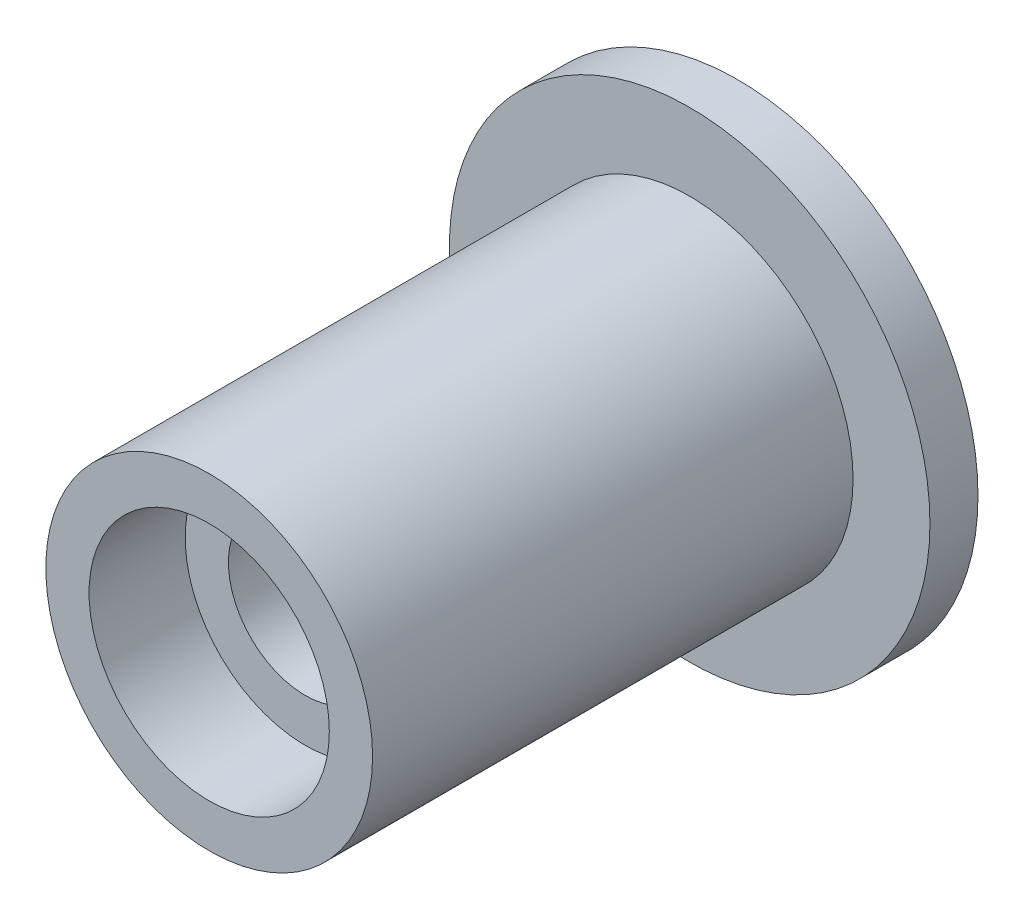
from build123d import *

# Parameters (mm, degrees)
SKETCH1_R           = 5
SKETCH1_R_2         = 1.6
BOSS_EXTRUDE1_DEPTH = 1
SKETCH1_3_R         = 3.4
SKETCH1_3_R_2       = 2.5
BOSS_EXTRUDE2_DEPTH = 10
SKETCH1_4_R         = 2.5
SKETCH1_4_R_2       = 1.6
BOSS_EXTRUDE3_DEPTH = 8


with BuildPart() as part:
    # Sketch1 → Boss-Extrude1 (new body)
    with BuildSketch(Plane.XY):
        Circle(SKETCH1_R)
        Circle(SKETCH1_R_2, mode=Mode.SUBTRACT)
    extrude(amount=-BOSS_EXTRUDE1_DEPTH)

    # Sketch1<3> → Boss-Extrude2 (add)
    with BuildSketch(Plane.XY):
        Circle(SKETCH1_3_R)
        Circle(SKETCH1_3_R_2, mode=Mode.SUBTRACT)
    extrude(amount=BOSS_EXTRUDE2_DEPTH)

    # Sketch1<4> → Boss-Extrude3 (add)
    with BuildSketch(Plane.XY):
        Circle(SKETCH1_4_R)
        Circle(SKETCH1_4_R_2, mode=Mode.SUBTRACT)
    extrude(amount=BOSS_EXTRUDE3_DEPTH)


solid = part.part
